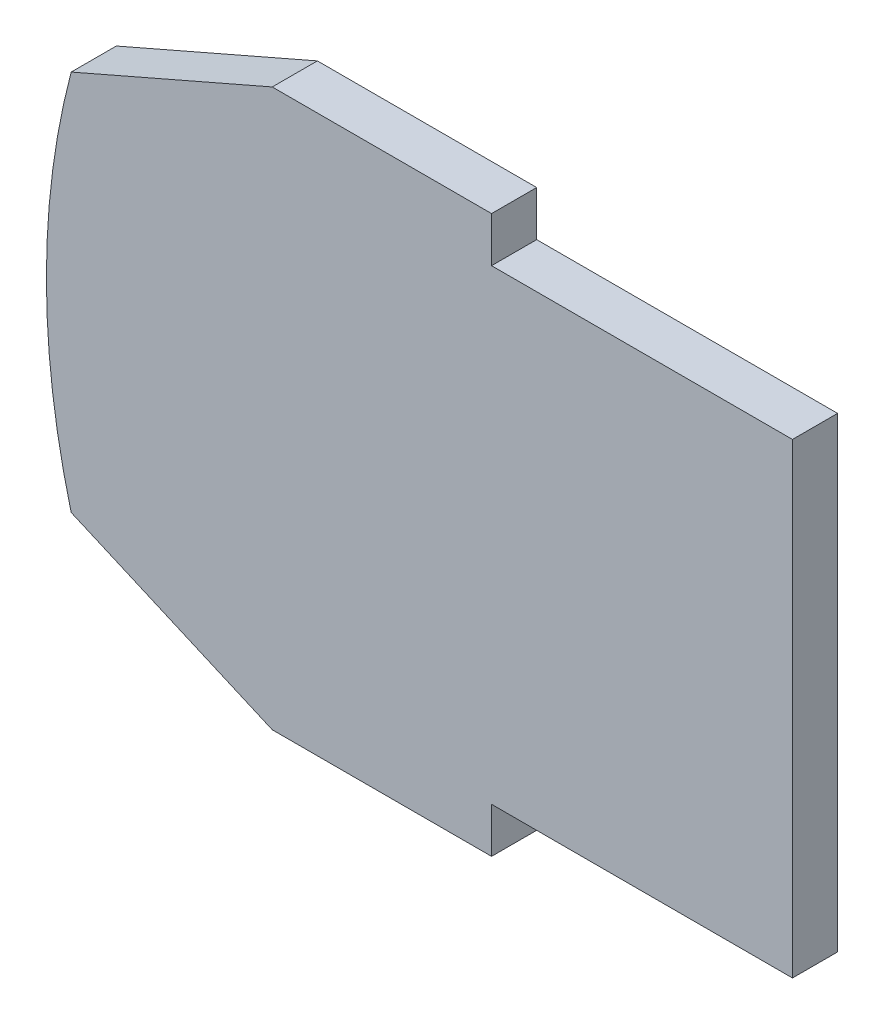
from build123d import *

# Parameters (mm, degrees)
BASE_EXTRUDE_DEPTH = 3


with BuildPart() as part:
    # Sketch1 → Base-Extrude (new body)
    with BuildSketch(Plane.XY):
        with BuildLine():
            Line((570.053994223, -52.227879558), (555.477414106, -52.227879558))
            Line((555.477414106, -52.227879558), (542.114900608, -58.051960683))
            ThreePointArc((542.114900608, -58.051960683), (540.467412221, -70.727788214), (542.114985017, -83.403604775))
            Line((542.114985017, -83.403604775), (555.477414106, -89.227879558))
            Line((555.477414106, -89.227879558), (570.053994223, -89.227879558))
            Line((570.053994223, -89.227879558), (570.053994223, -86.227879558))
            Line((570.053994223, -86.227879558), (590.053994223, -86.227879558))
            Line((590.053994223, -86.227879558), (590.053994223, -70.727623116))
            Line((590.053994223, -70.727623116), (590.053994223, -55.227879558))
            Line((590.053994223, -55.227879558), (570.053994223, -55.227879558))
            Line((570.053994223, -55.227879558), (570.053994223, -52.227879558))
        make_face()
    extrude(amount=BASE_EXTRUDE_DEPTH)


solid = part.part
